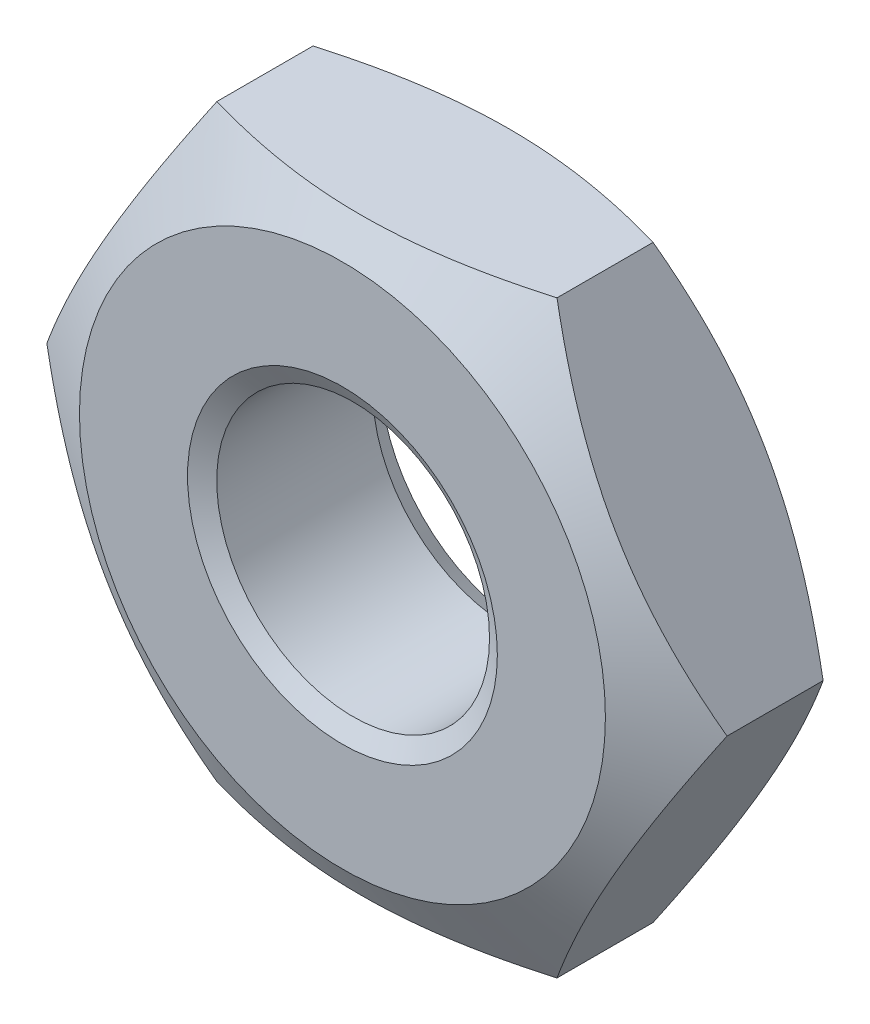
from build123d import *
from OCP.BRepFilletAPI import BRepFilletAPI_MakeChamfer

# Parameters (mm, degrees)
SKETCH1_R        = 1.621
BASENUT_DEPTH    = 2.2
ENDCHAMFER_SIZE  = 0.22
ENDCHAMFER_SIZE2 = 0.127017059


with BuildPart() as part:
    # Sketch1 → BaseNut (new body)
    with BuildSketch(Plane.XY):
        Polygon((2.020725942, -3.5), (4.041451884, 0), (2.020725942, 3.5), (-2.020725942, 3.5), (-4.041451884, 0), (-2.020725942, -3.5), align=None)
        Circle(SKETCH1_R, mode=Mode.SUBTRACT)
    extrude(amount=-BASENUT_DEPTH)

    # Sketch2 → Double-Chamfer (revolve, cut)
    with BuildSketch(Plane(origin=(0, 0, 0), x_dir=(1, 0, 0), z_dir=(0, 1, 0))):
        Polygon((-4.041451884, 2.2), (-3.125, 2.2), (-4.041451884, 1.670886258), align=None)
        Polygon((-4.041451884, 0.529113742), (-4.041451884, 0), (-3.125, 0), align=None)
    revolve(axis=Axis((0, 0, -3.375940562), (0, 0, 1)), mode=Mode.SUBTRACT)

    # EndChamfer: one chamfer whose edges measure the first distance from different faces: ONE call of the kernel's chamfer builder (chamfer() names one face for all edges)
    endchamfer_edges_1 = [part.edges().sort_by_distance(p)[0] for p in [
        (-1.621, 0, -2.2),
    ]]
    endchamfer_side_1 = [part.faces().sort_by_distance(p)[0] for p in [
        (-1.621, 0, -1.1),
    ]]
    endchamfer_edges_2 = [part.edges().sort_by_distance(p)[0] for p in [
        (-1.621, 0, 0),
    ]]
    endchamfer_side_2 = [part.faces().sort_by_distance(p)[0] for p in [
        (3.036611652, 0, 0),
    ]]
    endchamfer = BRepFilletAPI_MakeChamfer(part.part.solid().wrapped)
    for e in endchamfer_edges_1:
        endchamfer.Add(ENDCHAMFER_SIZE, ENDCHAMFER_SIZE2, e.wrapped, endchamfer_side_1[0].wrapped)  # the first distance lies on this face
    for e in endchamfer_edges_2:
        endchamfer.Add(ENDCHAMFER_SIZE, ENDCHAMFER_SIZE2, e.wrapped, endchamfer_side_2[0].wrapped)  # the first distance lies on this face
    add(Compound.cast(endchamfer.Shape()), mode=Mode.REPLACE)


solid = part.part
